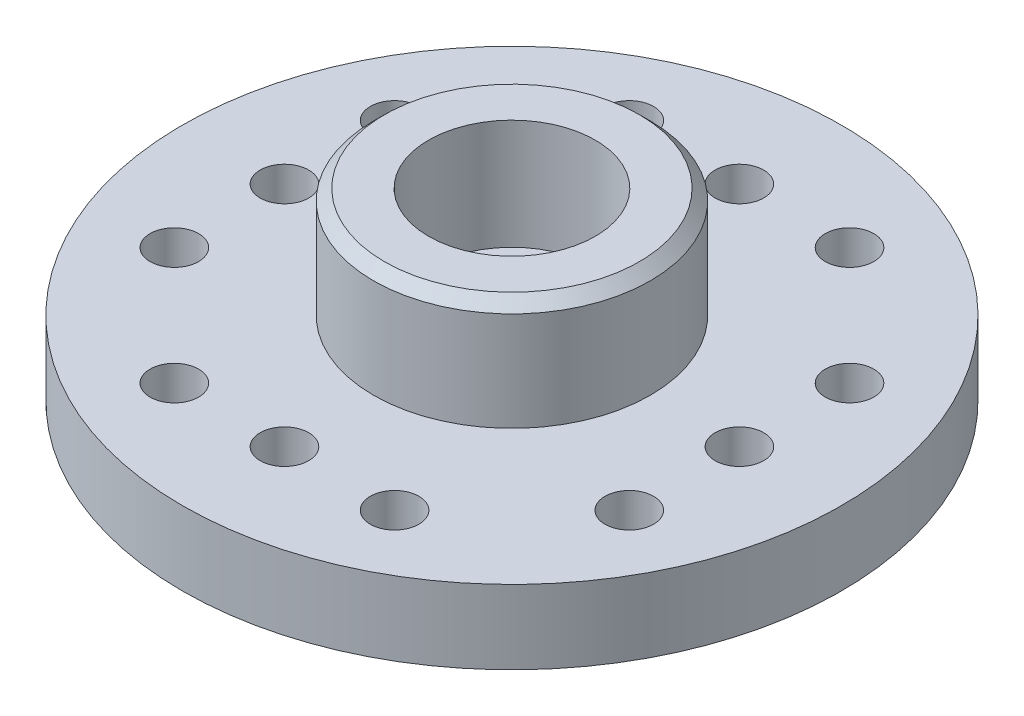
from build123d import *

# Parameters (mm, degrees)
SKETCH_2_R          = 10.475
SKETCH_2_R_2        = 4.4
SKETCH_2_R_3        = 0.771713969
EXTRUDE_1_DEPTH     = 2.35
SKETCH_3_R          = 4.4
SKETCH_3_R_2        = 2.65
EXTRUDE_2_DEPTH     = 3.5
CHAMFER_1_SIZE      = 0.35
SKETCH_4_R          = 4.4
EXTRUDE_3_DEPTH     = 2.35
SKETCH_5_R          = 3
CUT_EXTRUDE_1_DEPTH = 1
SKETCH_6_R          = 1.425
CUT_EXTRUDE_2_DEPTH = 1.35
SKETCH_7_R          = 4.325
SKETCH_7_R_2        = 3.5
CUT_EXTRUDE_3_DEPTH = 1


with BuildPart() as part:
    # 草图2 → 凸台-拉伸1 (new body)
    with BuildSketch(Plane(origin=(0, 0, 0), x_dir=(1, 0, 0), z_dir=(0, 1, 0))):
        with Locations(Location((0, 0, 0), (0, 0, 270))):
            Circle(SKETCH_2_R)
        with Locations(Location((0, 0, 0), (0, 0, 270))):
            Circle(SKETCH_2_R_2, mode=Mode.SUBTRACT)
        with Locations(Location((0, 7.23, 0), (0, 0, 270))):
            Circle(SKETCH_2_R_3, mode=Mode.SUBTRACT)
        with Locations(Location((-3.5, 7.23, 0), (0, 0, 270))):
            Circle(SKETCH_2_R_3, mode=Mode.SUBTRACT)
        with Locations(Location((3.5, 7.23, 0), (0, 0, 90))):
            Circle(SKETCH_2_R_3, mode=Mode.SUBTRACT)
        with Locations(Location((7.23, 3.5, 0), (0, 0, 270))):
            Circle(SKETCH_2_R_3, mode=Mode.SUBTRACT)
        with Locations(Location((7.23, 0, 0), (0, 0, 270))):
            Circle(SKETCH_2_R_3, mode=Mode.SUBTRACT)
        with Locations(Location((7.23, -3.5, 0), (0, 0, 90))):
            Circle(SKETCH_2_R_3, mode=Mode.SUBTRACT)
        with Locations(Location((3.5, -7.23, 0), (0, 0, 270))):
            Circle(SKETCH_2_R_3, mode=Mode.SUBTRACT)
        with Locations(Location((0, -7.23, 0), (0, 0, 270))):
            Circle(SKETCH_2_R_3, mode=Mode.SUBTRACT)
        with Locations(Location((-3.5, -7.23, 0), (0, 0, 90))):
            Circle(SKETCH_2_R_3, mode=Mode.SUBTRACT)
        with Locations(Location((-7.23, -3.5, 0), (0, 0, 270))):
            Circle(SKETCH_2_R_3, mode=Mode.SUBTRACT)
        with Locations(Location((-7.23, 0, 0), (0, 0, 270))):
            Circle(SKETCH_2_R_3, mode=Mode.SUBTRACT)
        with Locations(Location((-7.23, 3.5, 0), (0, 0, 90))):
            Circle(SKETCH_2_R_3, mode=Mode.SUBTRACT)
    extrude(amount=EXTRUDE_1_DEPTH)



with BuildPart() as body_2:
    # 草图3 → 凸台-拉伸2 (new body)
    with BuildSketch(Plane(origin=(0, 2.35, 0), x_dir=(1, 0, 0), z_dir=(0, 1, 0))):
        with Locations(Location((0, 0, 0), (0, 0, 270))):
            Circle(SKETCH_3_R)
        with Locations(Location((0, 0, 0), (0, 0, 270))):
            Circle(SKETCH_3_R_2, mode=Mode.SUBTRACT)
    extrude(amount=EXTRUDE_2_DEPTH)

    # 倒角1
    chamfer_1_edges = [body_2.edges().sort_by_distance(p)[0] for p in [
        (0, 5.85, -4.4),
    ]]
    chamfer(chamfer_1_edges, length=CHAMFER_1_SIZE)


with BuildPart() as part_1:
    add(part.part)

    add(body_2.part)  # 凸台-拉伸3 merges body 2
    # 草图4 → 凸台-拉伸3 (add)
    with BuildSketch(Plane.XZ):
        with Locations(Location((0, 0, 0), (0, 0, 270))):
            Circle(SKETCH_4_R)
    extrude(amount=-EXTRUDE_3_DEPTH)

    # 草图5 → 切除-拉伸1 (cut)
    with BuildSketch(Plane.XZ):
        with Locations(Location((0, 0, 0), (0, 0, 270))):
            Circle(SKETCH_5_R)
    extrude(amount=-CUT_EXTRUDE_1_DEPTH, mode=Mode.SUBTRACT)

    # 草图6 → 切除-拉伸2 (cut)
    with BuildSketch(Plane(origin=(0, 2.35, 0), x_dir=(1, 0, 0), z_dir=(0, 1, 0))):
        with Locations(Location((0, 0, 0), (0, 0, 270))):
            Circle(SKETCH_6_R)
    extrude(amount=-CUT_EXTRUDE_2_DEPTH, mode=Mode.SUBTRACT)

    # 草图7 → 切除-拉伸3 (cut)
    with BuildSketch(Plane.XZ):
        with Locations(Location((0, 0, 0), (0, 0, 270))):
            Circle(SKETCH_7_R)
        with Locations(Location((0, 0, 0), (0, 0, 270))):
            Circle(SKETCH_7_R_2, mode=Mode.SUBTRACT)
    extrude(amount=-CUT_EXTRUDE_3_DEPTH, mode=Mode.SUBTRACT)


solid = part_1.part
